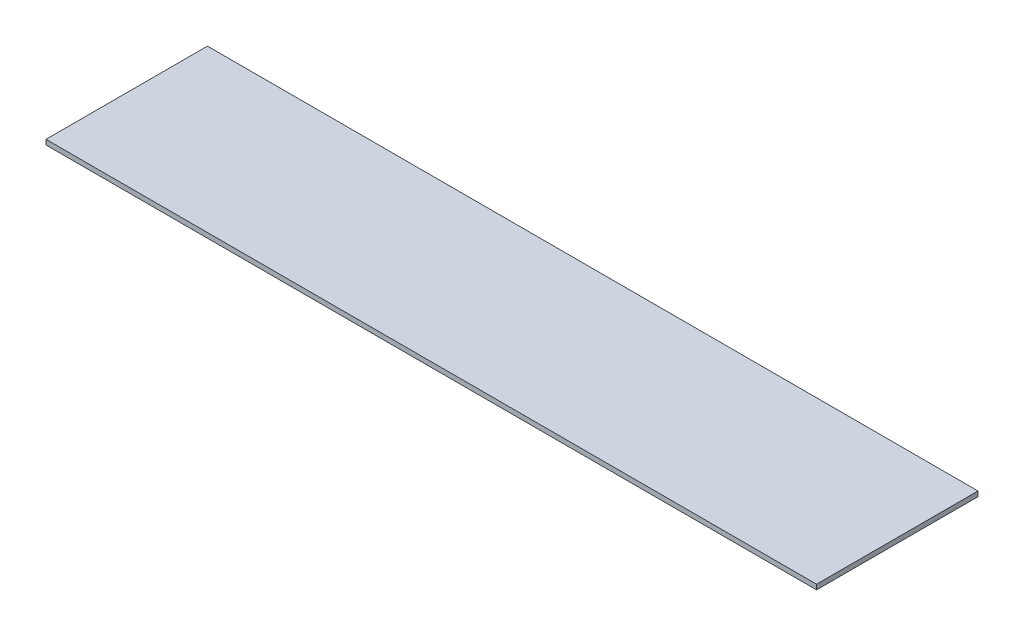
from build123d import *

# Parameters (mm, degrees)
SKETCH1_W           = 247.65
SKETCH1_H           = 51.889967989
BOSS_EXTRUDE1_DEPTH = 1.5875


with BuildPart() as part:
    # Sketch1 → Boss-Extrude1 (new body)
    with BuildSketch(Plane(origin=(0, 0, 0), x_dir=(1, 0, 0), z_dir=(0, 1, 0))):
        with Locations((123.825, -25.944983995)):
            Rectangle(SKETCH1_W, SKETCH1_H)
    extrude(amount=BOSS_EXTRUDE1_DEPTH)


solid = part.part
